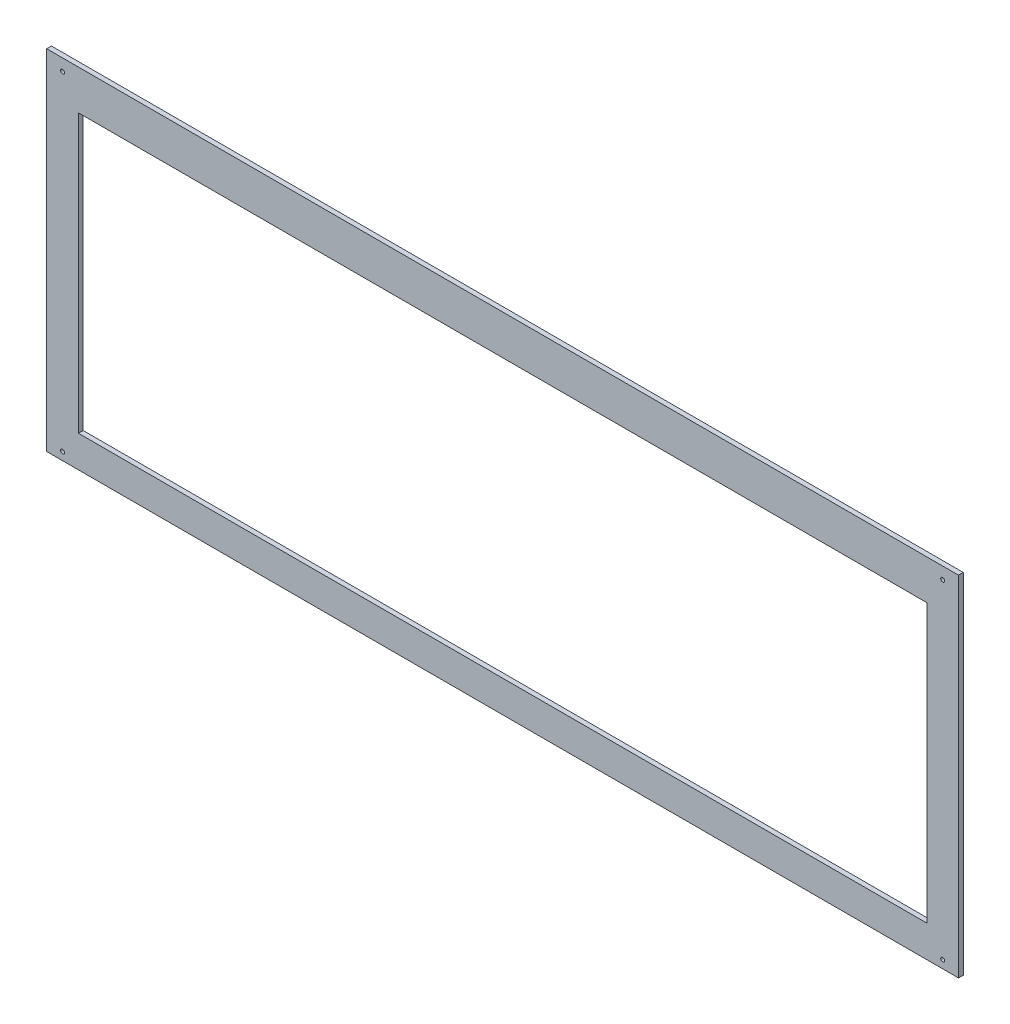
from build123d import *

# Parameters (mm, degrees)
SKETCH1_W           = 1070
SKETCH1_H           = 350
BOSS_EXTRUDE1_DEPTH = 6
SKETCH2_R           = 2.5
CUT_EXTRUDE1_DEPTH  = 618.483603021


with BuildPart() as part:
    # Sketch1 → Boss-Extrude1 (new body)
    with BuildSketch(Plane.XY):
        Polygon((575, -215), (575, 175), (575, 225), (535, 225), (-535, 225), (-575, 225), (-575, 175), (-575, -215), align=None)
        Rectangle(SKETCH1_W, SKETCH1_H, mode=Mode.SUBTRACT)
    extrude(amount=BOSS_EXTRUDE1_DEPTH)

    # Sketch2 → Cut-Extrude1 (cut, through all)
    with BuildSketch(Plane.XY.offset(6)):
        with Locations((-555, 210)):
            Circle(SKETCH2_R)
        with Locations((-555, -205)):
            Circle(SKETCH2_R)
        with Locations((555, -205)):
            Circle(SKETCH2_R)
        with Locations((555, 210)):
            Circle(SKETCH2_R)
    extrude(amount=-CUT_EXTRUDE1_DEPTH, mode=Mode.SUBTRACT)


solid = part.part
